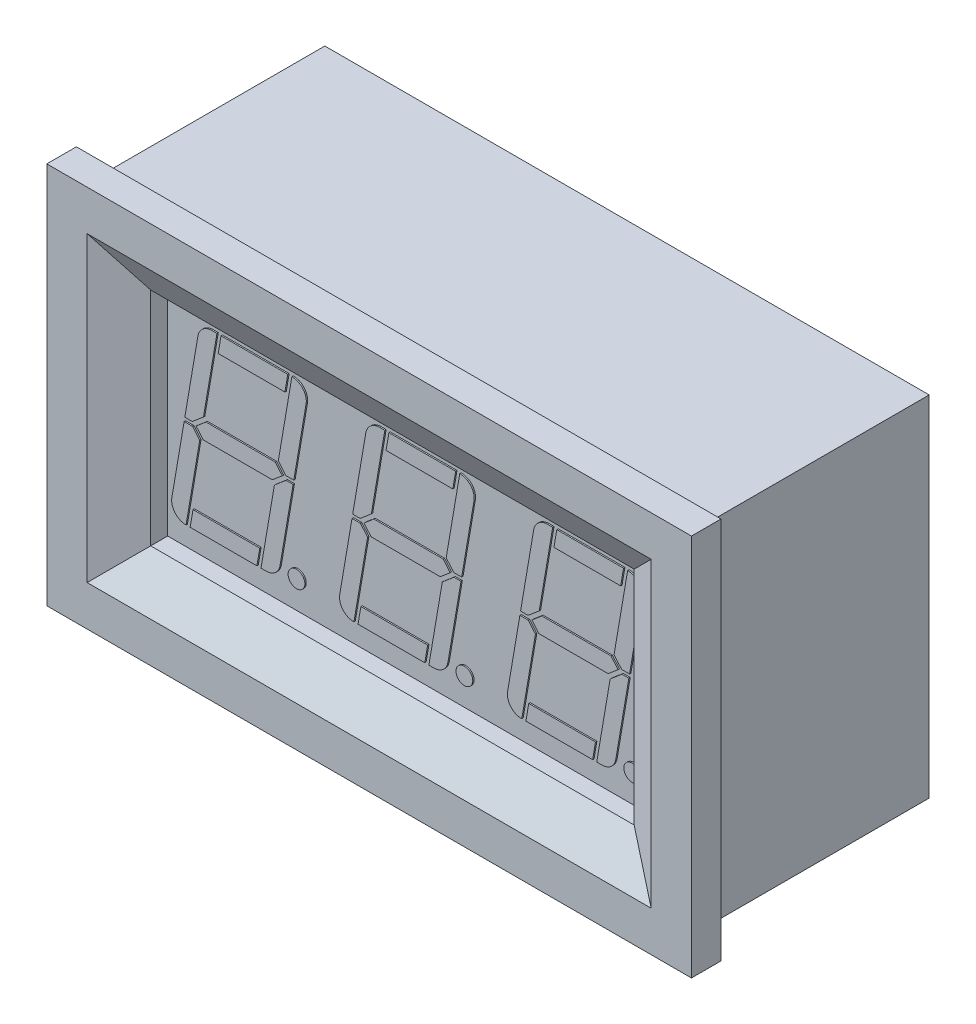
from build123d import *

# Parameters (mm, degrees)
SKETCH_1_W                     = 45
SKETCH_1_H                     = 26
EXTRUDE_1_DEPTH                = 17
SKETCH_2_W                     = 48
SKETCH_2_H                     = 28.5
EXTRUDE_2_DEPTH                = 2.2
SKETCH_3_W                     = 36
SKETCH_3_H                     = 16.5
CUT_EXTRUDE_1_DEPTH            = 3
CHAMFER_1_SIZE                 = 3
CHAMFER_1_SIZE2                = 1.732050808
SKETCH_4_R                     = 0.625
EXTRUDE_3_DEPTH                = 0.1
FILLET_1_R                     = 1.05
PATTERN_LINEAR_1_COUNT         = 3
PATTERN_LINEAR_1_PITCH         = 12.5
FILLET_1_OF_PATTERN_LINEAR_1_R = 1.05


with BuildPart() as part:
    # Эскиз1 → Бобышка-Вытянуть1 (new body)
    with BuildSketch(Plane.XY):
        Rectangle(SKETCH_1_W, SKETCH_1_H)
    extrude(amount=EXTRUDE_1_DEPTH)

    # Эскиз2 → Бобышка-Вытянуть2 (add)
    with BuildSketch(Plane.XY.offset(17)):
        Rectangle(SKETCH_2_W, SKETCH_2_H)
    extrude(amount=EXTRUDE_2_DEPTH)

    # Эскиз3 → Вырез-Вытянуть1 (cut)
    with BuildSketch(Plane.XY.offset(19.2)):
        Rectangle(SKETCH_3_W, SKETCH_3_H)
    extrude(amount=-CUT_EXTRUDE_1_DEPTH, mode=Mode.SUBTRACT)

    # Фаска1
    chamfer_1_edges = [part.edges().sort_by_distance(p)[0] for p in [
        (-18, 0, 19.2),
        (0, -8.25, 19.2),
        (18, 0, 19.2),
        (0, 8.25, 19.2),
    ]]
    chamfer_1_side = [part.faces().sort_by_distance(p)[0] for p in [
        (0, -13.691766178, 19.2),
    ]]
    chamfer(chamfer_1_edges, length=CHAMFER_1_SIZE, length2=CHAMFER_1_SIZE2, reference=chamfer_1_side[0])

    # Эскиз4 → Бобышка-Вытянуть3 (add)
    with BuildSketch(Plane.XY.offset(16.2)):
        with Locations((-8.310233245, -6.125)):
            Circle(SKETCH_4_R)
        Polygon((-17.8, -6.75), (-16.531988477, -6.75), (-15.515440373, -0.783304607), (-16.049974064, -0.15), (-16.675555556, -0.15), align=None)
        Polygon((-9.68472625, -6.75), (-8.560281805, -0.15), (-9.077616658, -0.15), (-9.954369729, -0.890013653), (-10.952737773, -6.75), align=None)
        Polygon((-15.5, 6.75), (-14.231988477, 6.75), (-15.236353449, 0.854814294), (-16.071403038, 0.15), (-16.624444444, 0.15), align=None)
        Polygon((-8.509170694, 0.15), (-9.099045632, 0.15), (-9.66328895, 0.818503966), (-8.652737773, 6.75), (-7.38472625, 6.75), align=None)
        Polygon((-15.784003603, 0), (-15.04351636, 0.625), (-9.892540373, 0.625), (-9.365016093, 0), (-10.105503336, -0.625), (-15.256479323, -0.625), align=None)
        Polygon((-13.927665711, 6.75), (-14.140628674, 5.5), (-9.170023502, 5.5), (-8.957060539, 6.75), align=None)
        Polygon((-16.227665711, -6.75), (-16.014702748, -5.5), (-11.044097576, -5.5), (-11.257060539, -6.75), align=None)
    extrude_3 = extrude(amount=EXTRUDE_3_DEPTH)

    # Скругление1
    fillet_1_edges = [part.edges().sort_by_distance(p)[0] for p in [
        (-17.8, -6.75, 16.25),
        (-9.68472625, -6.75, 16.25),
        (-7.38472625, 6.75, 16.25),
        (-15.5, 6.75, 16.25),
    ]]
    fillet(fillet_1_edges, radius=FILLET_1_R)

    # Линейный массив1: Бобышка-Вытянуть3 ×3
    with Locations(*[(i * PATTERN_LINEAR_1_PITCH, 0, 0) for i in range(1, PATTERN_LINEAR_1_COUNT)]):
        add(extrude_3)

    # Скругление1 of Линейный массив1
    fillet_1_of_pattern_linear_1_edges = [part.edges().sort_by_distance(p)[0] for p in [
        (-5.3, -6.75, 16.25),
        (2.81527375, -6.75, 16.25),
        (5.11527375, 6.75, 16.25),
        (-3, 6.75, 16.25),
        (7.2, -6.75, 16.25),
        (15.31527375, -6.75, 16.25),
        (17.61527375, 6.75, 16.25),
        (9.5, 6.75, 16.25),
    ]]
    fillet(fillet_1_of_pattern_linear_1_edges, radius=FILLET_1_OF_PATTERN_LINEAR_1_R)


solid = part.part
